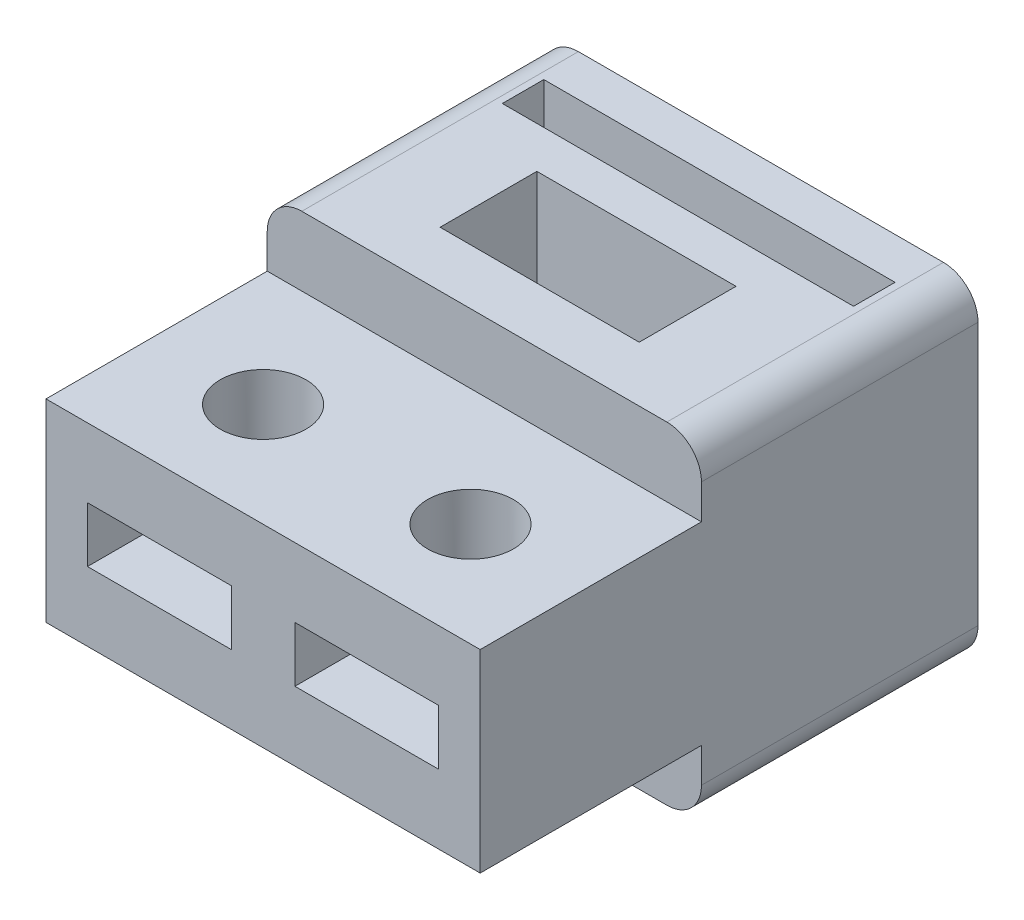
from build123d import *

# Parameters (mm, degrees)
SKETCH1_W                  = 15.7
SKETCH1_H                  = 18
SKETCH1_W_2                = 12.7
SKETCH1_H_2                = 1.5
BOSS_EXTRUDE1_DEPTH        = 12
CUT_EXTRUDE1_START         = -10
CUT_EXTRUDE1_DEPTH         = 3.5
M4_CLEARANCE_HOLE2_D       = 4.8
M4_CLEARANCE_HOLE2_DEPTH   = 10
M4_CLEARANCE_HOLE2_TIP     = 1.442065486
M2_5_CLEARANCE_HOLE1_D     = 3.1
M2_5_CLEARANCE_HOLE1_DEPTH = 10
M2_5_CLEARANCE_HOLE1_TIP   = 0.931333959
CUT_EXTRUDE3_START         = -6
SKETCH9_R                  = 1.55
CUT_EXTRUDE3_DEPTH         = 1
SKETCH14_W                 = 15.7
SKETCH14_H                 = 2.5
CUT_EXTRUDE5_DEPTH         = 8
FILLET1_R                  = 1.25


with BuildPart() as part:
    # Sketch1 → Boss-Extrude1 (new body)
    with BuildSketch(Plane(origin=(0, 0, 0), x_dir=(1, 0, 0), z_dir=(0, 1, 0))):
        with Locations((0, -6.75)):
            Rectangle(SKETCH1_W, SKETCH1_H)
        Rectangle(SKETCH1_W_2, SKETCH1_H_2, mode=Mode.SUBTRACT)
    extrude(amount=BOSS_EXTRUDE1_DEPTH)

    # Sketch2 → Cut-Extrude1 (cut)
    with BuildSketch(Plane.XY.offset(15.75).offset(CUT_EXTRUDE1_START)):
        Polygon((3.6, 12), (-3.6, 12), (-3.6, 8.078460969), (0, 10.156921938), (3.6, 8.078460969), align=None)
        Polygon((-3.6, 3.921539031), (0, 1.843078062), (3.6, 3.921539031), (3.6, 8.078460969), (0, 10.156921938), (-3.6, 8.078460969), align=None)
    extrude(amount=-CUT_EXTRUDE1_DEPTH, mode=Mode.SUBTRACT)

    # M4 Clearance Hole2
    with Locations(Plane(origin=(0, 0, -2.25), x_dir=(-1, 0, 0), z_dir=(0, 0, -1))):
        with Locations((0, 6)):
            Hole(M4_CLEARANCE_HOLE2_D / 2, depth=M4_CLEARANCE_HOLE2_DEPTH)
            with Locations((0, 0, -(M4_CLEARANCE_HOLE2_DEPTH + M4_CLEARANCE_HOLE2_TIP / 2))):  # 118° drill point
                Cone(0, M4_CLEARANCE_HOLE2_D / 2, M4_CLEARANCE_HOLE2_TIP, mode=Mode.SUBTRACT)

    # M2.5 Clearance Hole1
    with Locations(Plane(origin=(0, 12, 0), x_dir=(1, 0, 0), z_dir=(0, 1, 0))):
        with Locations((3.75, -12), (-3.75, -12)):
            Hole(M2_5_CLEARANCE_HOLE1_D / 2, depth=M2_5_CLEARANCE_HOLE1_DEPTH)
            with Locations((0, 0, -(M2_5_CLEARANCE_HOLE1_DEPTH + M2_5_CLEARANCE_HOLE1_TIP / 2))):  # 118° drill point
                Cone(0, M2_5_CLEARANCE_HOLE1_D / 2, M2_5_CLEARANCE_HOLE1_TIP, mode=Mode.SUBTRACT)

    # Sketch9 → Cut-Extrude3 (cut, symmetric)
    # profile 1 of 4: a face of its own
    with BuildSketch(Plane(origin=(0, 12, 0), x_dir=(1, 0, 0), z_dir=(0, 1, 0)).offset(CUT_EXTRUDE3_START)):
        Polygon((-3.75, -15.0022214), (-6.35, -13.5011107), (-6.35, -15.75), (-1.15, -15.75), (-1.15, -13.5011107), align=None)
    # profile 2 of 4: a face of its own
    with BuildSketch(Plane(origin=(0, 12, 0), x_dir=(1, 0, 0), z_dir=(0, 1, 0)).offset(CUT_EXTRUDE3_START)):
        Polygon((-6.35, -13.5011107), (-3.75, -15.0022214), (-1.15, -13.5011107), (-1.15, -10.4988893), (-3.75, -8.9977786), (-6.35, -10.4988893), align=None)
        with Locations(Location((-3.75, -12, 0), (0, 0, 270))):
            Circle(SKETCH9_R, mode=Mode.SUBTRACT)
    # profile 3 of 4: a face of its own
    with BuildSketch(Plane(origin=(0, 12, 0), x_dir=(1, 0, 0), z_dir=(0, 1, 0)).offset(CUT_EXTRUDE3_START)):
        Polygon((1.15, -13.5011107), (1.15, -15.75), (6.35, -15.75), (6.35, -13.5011107), (3.75, -15.0022214), align=None)
    # profile 4 of 4: a face of its own
    with BuildSketch(Plane(origin=(0, 12, 0), x_dir=(1, 0, 0), z_dir=(0, 1, 0)).offset(CUT_EXTRUDE3_START)):
        Polygon((1.15, -13.5011107), (3.75, -15.0022214), (6.35, -13.5011107), (6.35, -10.4988893), (3.75, -8.9977786), (1.15, -10.4988893), align=None)
        with Locations(Location((3.75, -12, 0), (0, 0, 270))):
            Circle(SKETCH9_R, mode=Mode.SUBTRACT)
    extrude(amount=CUT_EXTRUDE3_DEPTH, both=True, mode=Mode.SUBTRACT)

    # Sketch14 → Cut-Extrude5 (cut)
    with BuildSketch(Plane.XY.offset(15.75)):
        with Locations((0, 1.25)):
            Rectangle(SKETCH14_W, SKETCH14_H)
        with Locations((0, 10.75)):
            Rectangle(SKETCH14_W, SKETCH14_H)
    extrude(amount=-CUT_EXTRUDE5_DEPTH, mode=Mode.SUBTRACT)

    # Fillet1
    fillet1_edges = [part.edges().sort_by_distance(p)[0] for p in [
        (7.85, 0, 2.75),
        (7.85, 12, 2.75),
        (-7.85, 12, 2.75),
        (-7.85, 0, 2.75),
    ]]
    fillet(fillet1_edges, radius=FILLET1_R)


solid = part.part
